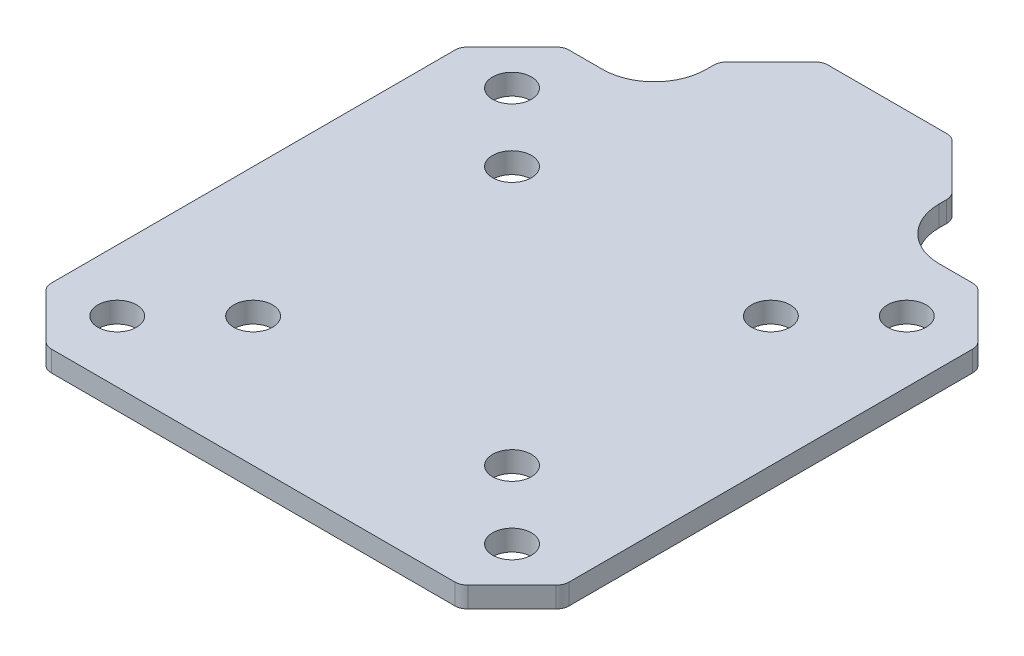
from build123d import *

# Parameters (mm, degrees)
SKETCH1_R           = 1.5
BOSS_EXTRUDE1_DEPTH = 1.6
CHAMFER1_SIZE       = 4
FILLET1_R           = 1


with BuildPart() as part:
    # Sketch1 → Boss-Extrude1 (new body)
    with BuildSketch(Plane(origin=(0, 0, 0), x_dir=(1, 0, 0), z_dir=(0, 1, 0))):
        with BuildLine():
            Line((13, 20), (20, 20))
            Line((20, 20), (20, -20))
            Line((20, -20), (-20, -20))
            Line((-20, -20), (-20, 20))
            Line((-20, 20), (-13, 20))
            ThreePointArc((-13, 20), (-10.171572875, 21.171572875), (-9, 24))
            Line((-9, 24), (-9, 29))
            Line((-9, 29), (9, 29))
            Line((9, 29), (9, 24))
            ThreePointArc((9, 24), (10.171572875, 21.171572875), (13, 20))
        make_face()
        with Locations(Location((-15.25, 15.25, 0), (0, 0, 270))):
            Circle(SKETCH1_R, mode=Mode.SUBTRACT)
        with Locations(Location((-10, 10, 0), (0, 0, 270))):
            Circle(SKETCH1_R, mode=Mode.SUBTRACT)
        with Locations(Location((10, 10, 0), (0, 0, 270))):
            Circle(SKETCH1_R, mode=Mode.SUBTRACT)
        with Locations(Location((-10, -10, 0), (0, 0, 270))):
            Circle(SKETCH1_R, mode=Mode.SUBTRACT)
        with Locations(Location((-15.25, -15.25, 0), (0, 0, 270))):
            Circle(SKETCH1_R, mode=Mode.SUBTRACT)
        with Locations(Location((15.25, -15.25, 0), (0, 0, 270))):
            Circle(SKETCH1_R, mode=Mode.SUBTRACT)
        with Locations(Location((10, -10, 0), (0, 0, 270))):
            Circle(SKETCH1_R, mode=Mode.SUBTRACT)
        with Locations(Location((15.25, 15.25, 0), (0, 0, 270))):
            Circle(SKETCH1_R, mode=Mode.SUBTRACT)
    extrude(amount=BOSS_EXTRUDE1_DEPTH)

    # Chamfer1
    chamfer1_edges = [part.edges().sort_by_distance(p)[0] for p in [
        (20, 0.8, 20),
        (-20, 0.8, 20),
        (-20, 0.8, -20),
        (-9, 0.8, -29),
        (9, 0.8, -29),
        (20, 0.8, -20),
    ]]
    chamfer(chamfer1_edges, length=CHAMFER1_SIZE)

    # Fillet1
    fillet1_edges = [part.edges().sort_by_distance(p)[0] for p in [
        (-5, 0.8, -29),
        (5, 0.8, -29),
        (9, 0.8, -25),
        (-9, 0.8, -25),
        (-20, 0.8, 16),
        (-20, 0.8, -16),
        (-16, 0.8, -20),
        (16, 0.8, -20),
        (20, 0.8, 16),
        (20, 0.8, -16),
        (-16, 0.8, 20),
        (16, 0.8, 20),
    ]]
    fillet(fillet1_edges, radius=FILLET1_R)


solid = part.part
